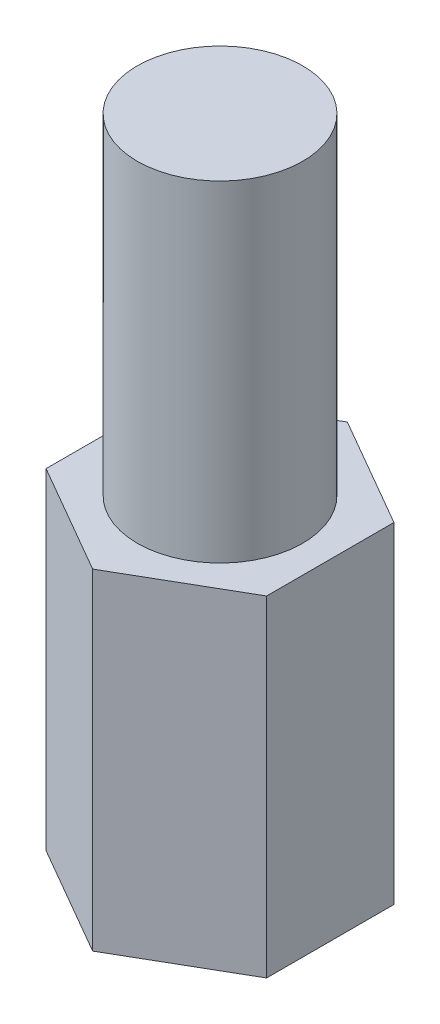
from build123d import *

# Parameters (mm, degrees)
SKETCH_1_R           = 1.5
EXTRUDE_1_DEPTH      = 6
EXTRUDE_2_DEPTH      = 6
EXTRUDE_2_DEPTH_BACK = 2
SKETCH_2_R           = 1.5


with BuildPart() as part:
    # 草图1 → 凸台-拉伸1 (new body)
    with BuildSketch(Plane(origin=(0, 0, 0), x_dir=(1, 0, 0), z_dir=(0, 1, 0))):
        Polygon((0, 2.309401077), (-2, 1.154700538), (-2, -1.154700538), (0, -2.309401077), (2, -1.154700538), (2, 1.154700538), align=None)
        with Locations(Location((0, 0, 0), (0, 0, 270))):
            Circle(SKETCH_1_R, mode=Mode.SUBTRACT)
    extrude(amount=EXTRUDE_1_DEPTH)

    # 草图2 → 凸台-拉伸2 (add, two sides: drawn at the far end of the back side and taken through both)
    with BuildSketch(Plane(origin=(0, 6, 0), x_dir=(1, 0, 0), z_dir=(0, 1, 0)).offset(-EXTRUDE_2_DEPTH_BACK)):
        with Locations(Location((0, 0, 0), (0, 0, 270))):
            Circle(SKETCH_2_R)
    extrude(amount=EXTRUDE_2_DEPTH + EXTRUDE_2_DEPTH_BACK)


solid = part.part
